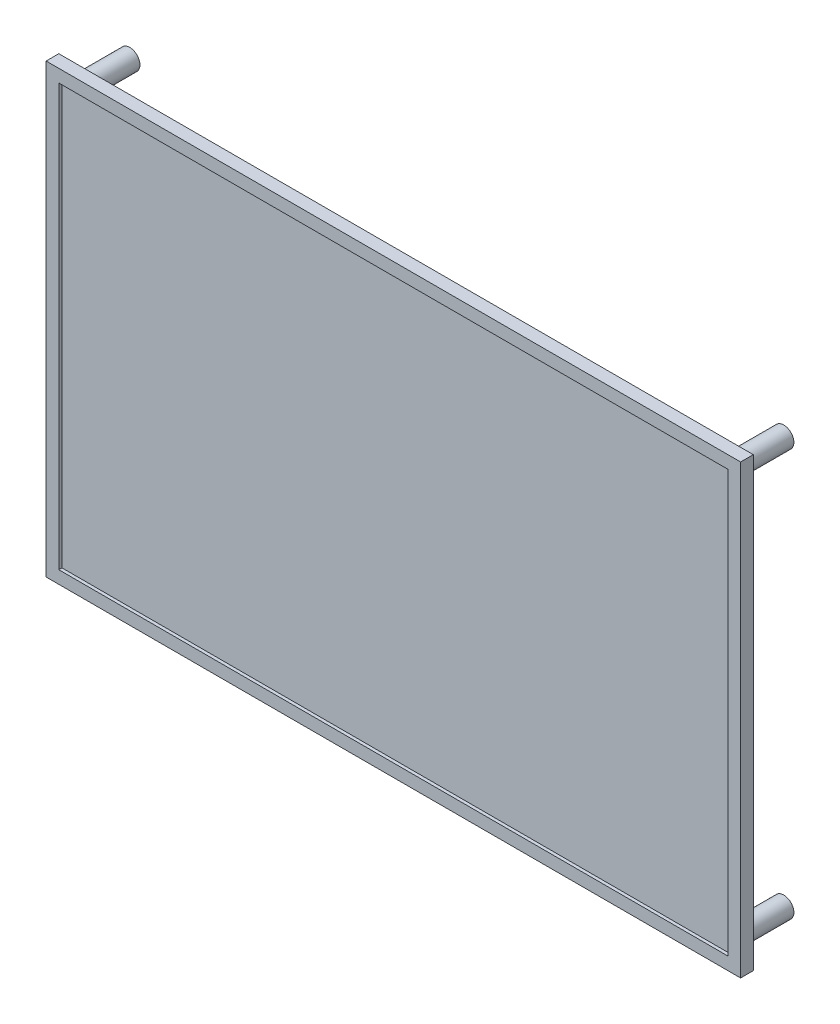
from build123d import *

# Parameters (mm, degrees)
SKETCH_1_R          = 1.6
EXTRUDE_1_DEPTH     = 8
EXTRUDE_1_2_DEPTH   = 8
EXTRUDE_1_3_DEPTH   = 8
EXTRUDE_1_4_DEPTH   = 8
SKETCH_2_W          = 109.546924753
SKETCH_2_H          = 70.491732923
EXTRUDE_2_DEPTH     = 2
SKETCH_3_W          = 105.546924753
SKETCH_3_H          = 66.491732923
CUT_EXTRUDE_1_DEPTH = 0.5


with BuildPart() as part:
    # 草图1 → 凸台-拉伸1 (new body)
    with BuildSketch(Plane.XY):
        with Locations((320.970675526, 77.650698191)):
            Circle(SKETCH_1_R)
    extrude(amount=EXTRUDE_1_DEPTH)



with BuildPart() as body_2:
    # 草图1 → Extrude 1 2 (new body)
    with BuildSketch(Plane.XY):
        with Locations(Location((320.970675526, 13.440898947, 0), (0, 0, 180))):
            Circle(SKETCH_1_R)
    extrude(amount=EXTRUDE_1_2_DEPTH)


with BuildPart() as body_3:
    # 草图1 → Extrude 1 3 (new body)
    with BuildSketch(Plane.XY):
        with Locations((217.817076829, 13.440898947)):
            Circle(SKETCH_1_R)
    extrude(amount=EXTRUDE_1_3_DEPTH)


with BuildPart() as body_4:
    # 草图1 → Extrude 1 4 (new body)
    with BuildSketch(Plane.XY):
        with Locations(Location((217.817076829, 77.650698191, 0), (0, 0, 180))):
            Circle(SKETCH_1_R)
    extrude(amount=EXTRUDE_1_4_DEPTH)


with BuildPart() as part_1:
    add(part.part)

    add(body_2.part)  # 凸台-拉伸2 merges body 2

    add(body_3.part)  # 凸台-拉伸2 merges body 3

    add(body_4.part)  # 凸台-拉伸2 merges body 4
    # 草图2 → 凸台-拉伸2 (add)
    with BuildSketch(Plane.XY.offset(8)):
        with Locations((269.393876178, 45.545798569)):
            Rectangle(SKETCH_2_W, SKETCH_2_H)
    extrude(amount=EXTRUDE_2_DEPTH)

    # 草图3 → 切除-拉伸1 (cut)
    with BuildSketch(Plane.XY.offset(10)):
        with Locations((269.393876178, 45.545798569)):
            Rectangle(SKETCH_3_W, SKETCH_3_H)
    extrude(amount=-CUT_EXTRUDE_1_DEPTH, mode=Mode.SUBTRACT)


solid = part_1.part
